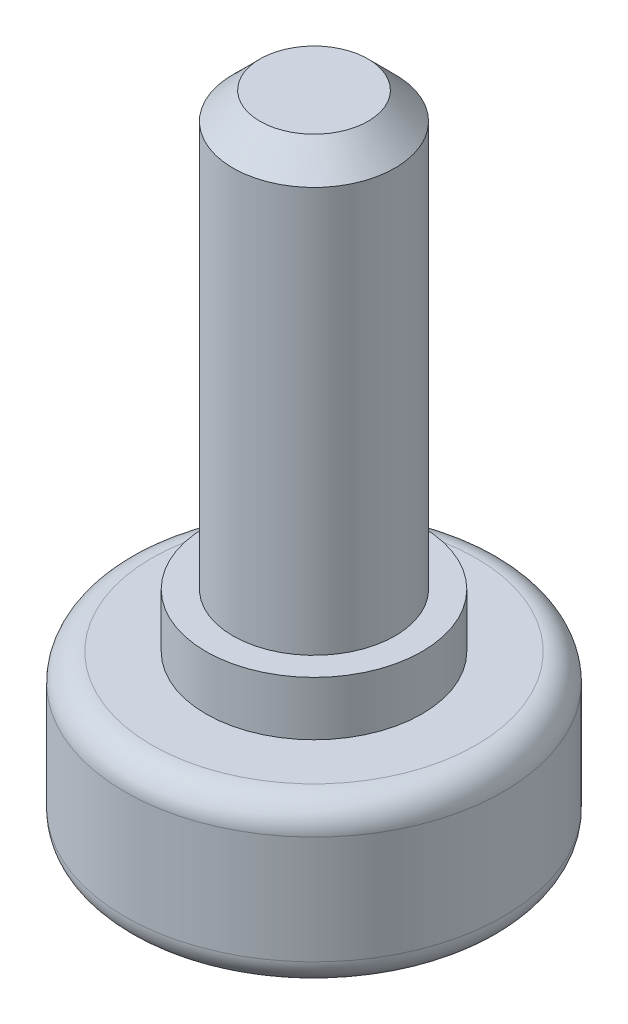
from build123d import *

# Parameters (mm, degrees)
SKETCH_1_R          = 3.5
EXTRUDE_1_DEPTH     = 3
SKETCH_2_R          = 2
EXTRUDE_2_DEPTH     = 1
SKETCH_3_R          = 1.5
EXTRUDE_3_DEPTH     = 8
SKETCH_4_R          = 1
CUT_EXTRUDE_1_DEPTH = 1.5
FILLET_1_R          = 0.5
CHAMFER_1_SIZE      = 0.5


with BuildPart() as part:
    # 草图1 → 凸台-拉伸1 (new body)
    with BuildSketch(Plane(origin=(0, 0, 0), x_dir=(1, 0, 0), z_dir=(0, 1, 0))):
        with Locations(Location((0, 0, 0), (0, 0, 270))):
            Circle(SKETCH_1_R)
    extrude(amount=EXTRUDE_1_DEPTH)

    # 草图2 → 凸台-拉伸2 (add)
    with BuildSketch(Plane(origin=(0, 3, 0), x_dir=(1, 0, 0), z_dir=(0, 1, 0))):
        with Locations(Location((0, 0, 0), (0, 0, 270))):
            Circle(SKETCH_2_R)
    extrude(amount=EXTRUDE_2_DEPTH)

    # 草图3 → 凸台-拉伸3 (add)
    with BuildSketch(Plane(origin=(0, 4, 0), x_dir=(1, 0, 0), z_dir=(0, 1, 0))):
        with Locations(Location((0, 0, 0), (0, 0, 270))):
            Circle(SKETCH_3_R)
    extrude(amount=EXTRUDE_3_DEPTH)

    # 草图4 → 切除-拉伸1 (cut)
    with BuildSketch(Plane.XZ):
        with Locations(Location((0, 0, 0), (0, 0, 270))):
            Circle(SKETCH_4_R)
    extrude(amount=-CUT_EXTRUDE_1_DEPTH, mode=Mode.SUBTRACT)

    # 圆角1
    fillet_1_edges = [part.edges().sort_by_distance(p)[0] for p in [
        (0, 0, -3.5),
        (0, 3, -3.5),
    ]]
    fillet(fillet_1_edges, radius=FILLET_1_R)

    # 倒角1
    chamfer_1_edges = [part.edges().sort_by_distance(p)[0] for p in [
        (0, 12, -1.5),
    ]]
    chamfer(chamfer_1_edges, length=CHAMFER_1_SIZE)


solid = part.part
